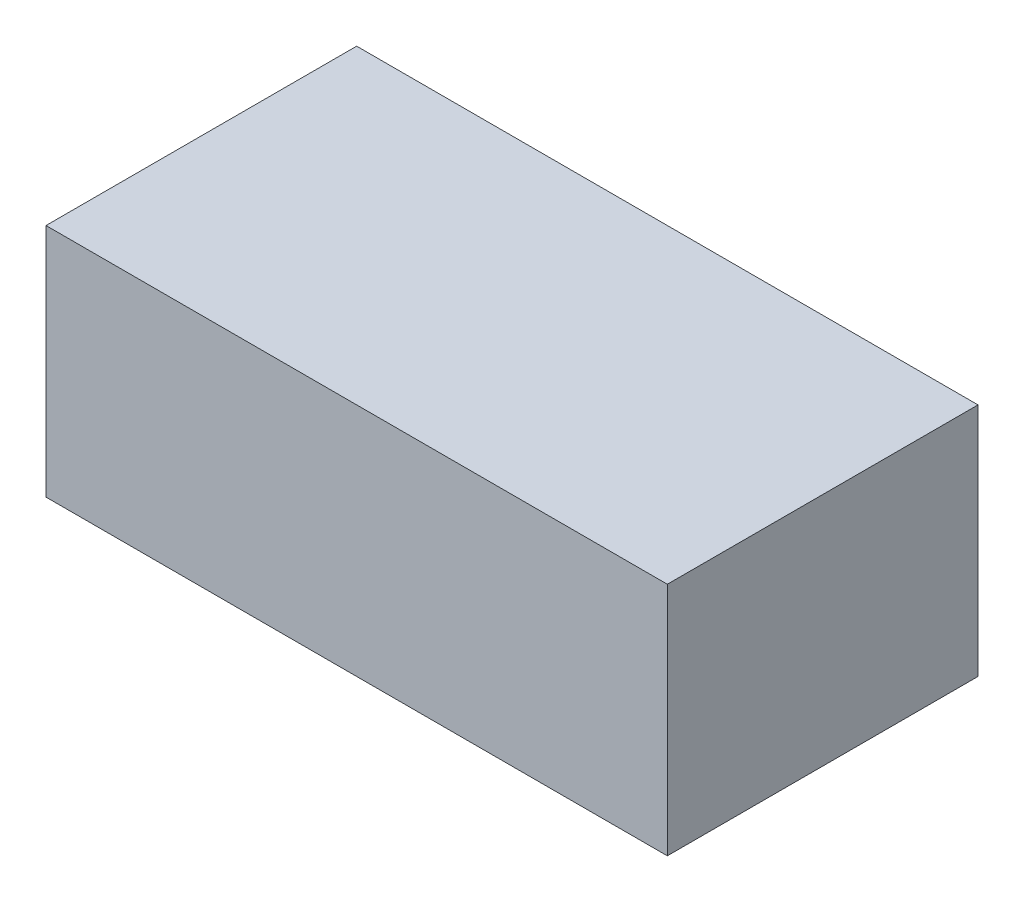
from build123d import *

# Parameters (mm, degrees)
SKETCH_1_W      = 140
SKETCH_1_H      = 70
EXTRUDE_1_DEPTH = 26.5


with BuildPart() as part:
    # 草图1 → 凸台-拉伸1 (new, symmetric)
    with BuildSketch(Plane(origin=(0, 0, 0), x_dir=(1, 0, 0), z_dir=(0, 1, 0))):
        Rectangle(SKETCH_1_W, SKETCH_1_H)
    extrude(amount=EXTRUDE_1_DEPTH, both=True)


solid = part.part
